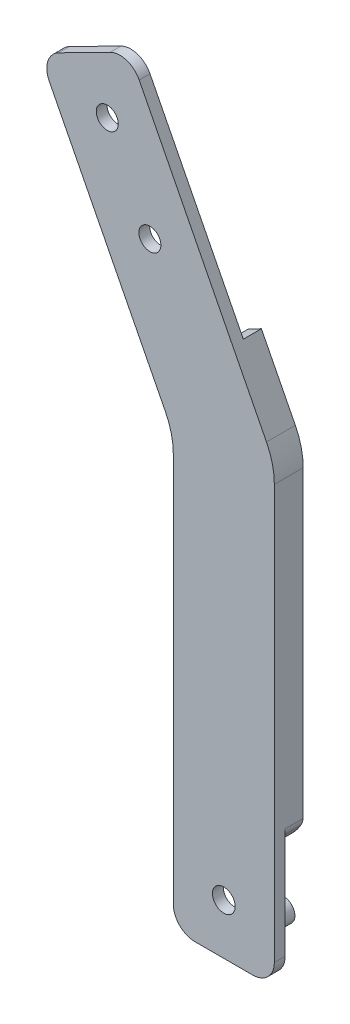
from build123d import *
from OCP.BRepFilletAPI import BRepFilletAPI_MakeFillet

# Parameters (mm, degrees)
SCHIZZO2_R                   = 1.575
SCHIZZO2_R_2                 = 1.525
ESTRUSIONE_ESTRUSIONE1_DEPTH = 1.5
RACCORDO1_R1                 = 3
RACCORDO1_R2                 = 10
SCHIZZO4_R                   = 1.55
ESTRUSIONE_ESTRUSIONE2_DEPTH = 2.5
ESTRUSIONE_ESTRUSIONE3_DEPTH = 2.5


with BuildPart() as part:
    # Schizzo2 → Estrusione-Estrusione1 (new body)
    with BuildSketch(Plane.XY):
        Polygon((10.835450111, 45.456844872), (10.835450111, 104.878132603), (-7.726239407, 141.30749945), (4.747851932, 147.663366447), (24.835450111, 108.23923523), (24.835450111, 45.456844872), align=None)
        with Locations((17.835450111, 52.456844872)):
            Circle(SCHIZZO2_R, mode=Mode.SUBTRACT)
        with Locations((1.688739761, 138.248387279)):
            Circle(SCHIZZO2_R_2, mode=Mode.SUBTRACT)
        with Locations((7.590616257, 126.665302465)):
            Circle(SCHIZZO2_R_2, mode=Mode.SUBTRACT)
    extrude(amount=ESTRUSIONE_ESTRUSIONE1_DEPTH)

    # Raccordo1: one fillet with a radius per group of edges: ONE call of the kernel's fillet builder (fillet() takes one radius for all edges)
    raccordo1_edges_1 = [part.edges().sort_by_distance(p)[0] for p in [
        (4.747851932, 147.663366447, 0.75),
        (-7.726239407, 141.30749945, 0.75),
        (10.835450111, 45.456844872, 0.75),
        (24.835450111, 45.456844872, 0.75),
    ]]
    raccordo1_edges_2 = [part.edges().sort_by_distance(p)[0] for p in [
        (24.835450111, 108.23923523, 0.75),
        (10.835450111, 104.878132603, 0.75),
    ]]
    raccordo1 = BRepFilletAPI_MakeFillet(part.part.solid().wrapped)
    for e in raccordo1_edges_1:
        raccordo1.Add(RACCORDO1_R1, e.wrapped)
    for e in raccordo1_edges_2:
        raccordo1.Add(RACCORDO1_R2, e.wrapped)
    add(Compound.cast(raccordo1.Shape()), mode=Mode.REPLACE)

    # Schizzo4 → Estrusione-Estrusione2 (add)
    with BuildSketch(Plane(origin=(0, 0, 0), x_dir=(-1, 0, 0), z_dir=(0, 0, -1))):
        with Locations(Location((-13.532140626, 53.421016786, 0), (0, 0, 180))):
            Circle(SCHIZZO4_R)
        with Locations(Location((-22.138759596, 51.492672958, 0), (0, 0, 180))):
            Circle(SCHIZZO4_R)
    extrude(amount=ESTRUSIONE_ESTRUSIONE2_DEPTH)

    # Schizzo5 → Estrusione-Estrusione3 (add)
    with BuildSketch(Plane(origin=(0, 0, 0), x_dir=(-1, 0, 0), z_dir=(0, 0, -1))):
        with BuildLine():
            Line((-24.835450111, 63.770542244), (-19.320054404, 59.217112451))
            Line((-19.320054404, 59.217112451), (-14.402001203, 59.217112451))
            add(Edge.make_bspline(
                [(-14.402001203, 59.217112451), (-13.28177849, 59.164141407), (-11.913165696, 58.833942628), (-10.835450111, 58.162340852)],
                knots=[0, 0, 0, 0, 0.33692331, 0.33692331, 0.33692331, 0.33692331], degree=3))
            Line((-10.835450111, 58.162340852), (-10.835450111, 102.477345012))
            ThreePointArc((-10.835450111, 102.477345012), (-10.559149315, 104.811798651), (-9.745515353, 107.01725001))
            Line((-9.745515353, 107.01725001), (-6.567581855, 113.254295679))
            Line((-6.567581855, 113.254295679), (-8.349594903, 114.162276678))
            Line((-8.349594903, 114.162276678), (-11.527528401, 107.925231009))
            ThreePointArc((-11.527528401, 107.925231009), (-12.503889156, 105.278689378), (-12.835450111, 102.477345012))
            Line((-12.835450111, 102.477345012), (-12.835450111, 69.217112451))
            Line((-12.835450111, 69.217112451), (-22.835450111, 69.217112451))
            Line((-22.835450111, 69.217112451), (-22.835450111, 105.838447639))
            ThreePointArc((-22.835450111, 105.838447639), (-22.614409474, 107.70601055), (-21.963502304, 109.470371637))
            Line((-21.963502304, 109.470371637), (-17.259660145, 118.702181676))
            Line((-17.259660145, 118.702181676), (-19.041673193, 119.610162675))
            Line((-19.041673193, 119.610162675), (-23.745515353, 110.378352637))
            ThreePointArc((-23.745515353, 110.378352637), (-24.559149315, 108.172901278), (-24.835450111, 105.838447639))
            Line((-24.835450111, 105.838447639), (-24.835450111, 63.770542244))
        make_face()
        with BuildLine():
            Line((-19.320054404, 59.217112451), (-24.835450111, 63.770542244))
            ThreePointArc((-24.835450111, 63.770542244), (-24.711960876, 63.245404245), (-24.488566128, 62.75437034))
            ThreePointArc((-24.488566128, 62.75437034), (-22.305073607, 60.400160674), (-19.320054404, 59.217112451))
        make_face()
    extrude(amount=ESTRUSIONE_ESTRUSIONE3_DEPTH)


solid = part.part
